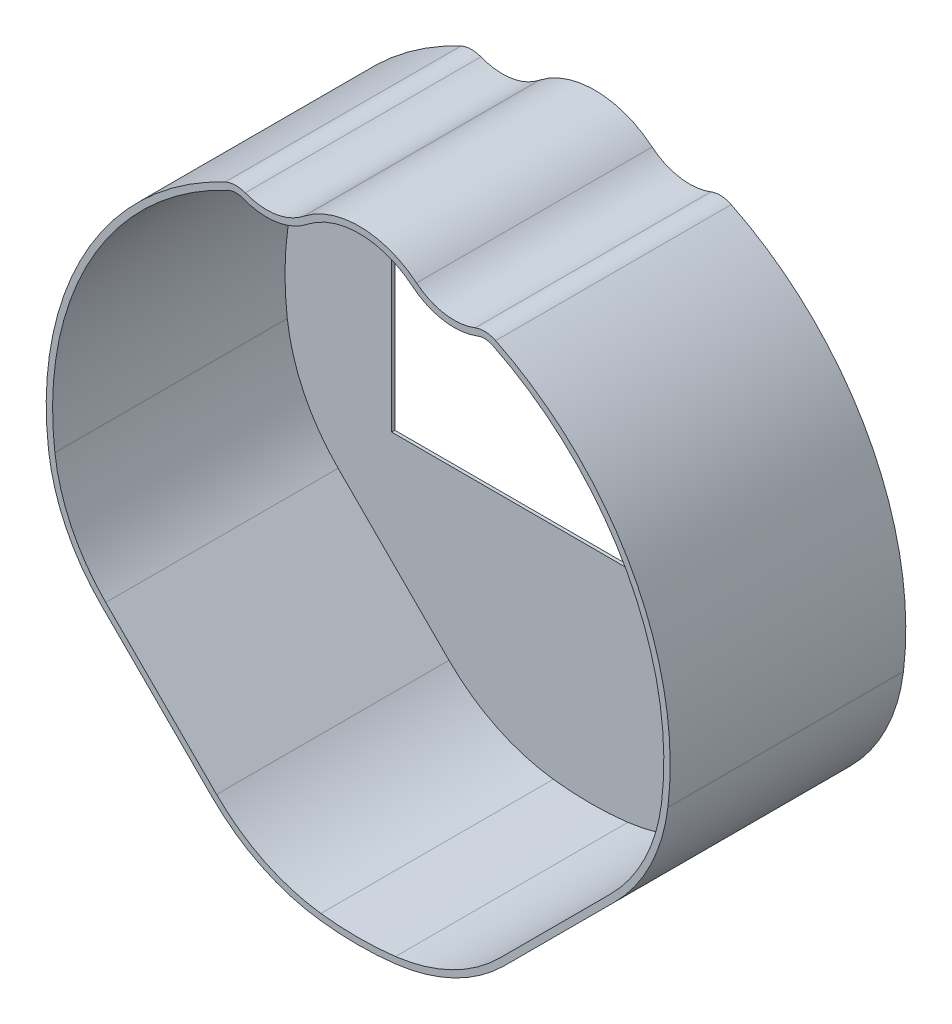
from build123d import *

# Parameters (mm, degrees)
BOSS_EXTRUDE1_DEPTH = 37
CUT_EXTRUDE1_DEPTH  = 36.5
CUT_EXTRUDE2_REACH  = 80.556
SKETCH5_W           = 63.5
SKETCH5_H           = 28


with BuildPart() as part:
    # Sketch1 → Boss-Extrude1 (new body)
    with BuildSketch(Plane.XY):
        with BuildLine():
            Line((40.356535193, -22.947426174), (22.947426174, -40.356535193))
            ThreePointArc((22.947426174, -40.356535193), (15.156681171, -45.914203278), (5.981257322, -48.63357442))
            ThreePointArc((5.981257322, -48.63357442), (0, -49), (-5.981257322, -48.63357442))
            ThreePointArc((-5.981257322, -48.63357442), (-15.156681171, -45.914203278), (-22.947426174, -40.356535193))
            Line((-22.947426174, -40.356535193), (-40.356535193, -22.947426174))
            ThreePointArc((-40.356535193, -22.947426174), (-45.914203278, -15.156681171), (-48.63357442, -5.981257322))
            ThreePointArc((-48.63357442, -5.981257322), (-42.907888217, 23.662483572), (-20.892307913, 44.322809817))
            ThreePointArc((-20.892307913, 44.322809817), (-19.322951214, 44.702303901), (-17.73141344, 44.430451502))
            ThreePointArc((-17.73141344, 44.430451502), (-12.910393927, 43.910800792), (-8.488178405, 45.899839725))
            ThreePointArc((-8.488178405, 45.899839725), (0.386708758, 48.850803922), (9.16390657, 45.62084875))
            ThreePointArc((9.16390657, 45.62084875), (13.572775182, 43.625772556), (18.385878971, 44.128249799))
            ThreePointArc((18.385878971, 44.128249799), (20.002215513, 44.392928913), (21.589134046, 43.987603835))
            ThreePointArc((21.589134046, 43.987603835), (43.093258956, 23.323186587), (48.63357442, -5.981257322))
            ThreePointArc((48.63357442, -5.981257322), (45.914203278, -15.156681171), (40.356535193, -22.947426174))
        make_face()
    extrude(amount=BOSS_EXTRUDE1_DEPTH)

    # Sketch3 → Cut-Extrude1 (cut)
    with BuildSketch(Plane.XY.offset(37)):
        with BuildLine():
            Line((-39.649428412, -22.240319392), (-22.240319392, -39.649428412))
            ThreePointArc((-22.240319392, -39.649428412), (-14.718220769, -45.015452769), (-5.859190846, -47.641052493))
            ThreePointArc((-5.859190846, -47.641052493), (0, -48), (5.859190846, -47.641052493))
            ThreePointArc((5.859190846, -47.641052493), (14.718220769, -45.015452769), (22.240319392, -39.649428412))
            Line((22.240319392, -39.649428412), (39.649428412, -22.240319392))
            ThreePointArc((39.649428412, -22.240319392), (45.015452769, -14.718220769), (47.641052493, -5.859190846))
            ThreePointArc((47.641052493, -5.859190846), (42.213804691, 22.847203188), (21.148539474, 43.089897634))
            ThreePointArc((21.148539474, 43.089897634), (19.958350574, 43.393891443), (18.746098167, 43.195382107))
            ThreePointArc((18.746098167, 43.195382107), (13.413001918, 42.638618817), (8.52781313, 44.849236713))
            ThreePointArc((8.52781313, 44.849236713), (0.378047137, 47.850813988), (-7.865478644, 45.117238565))
            ThreePointArc((-7.865478644, 45.117238565), (-12.761098878, 42.921980343), (-18.095263428, 43.498993941))
            ThreePointArc((-18.095263428, 43.498993941), (-19.288916758, 43.702883241), (-20.465934283, 43.418262678))
            ThreePointArc((-20.465934283, 43.418262678), (-42.032217029, 23.179575744), (-47.641052493, -5.859190846))
            ThreePointArc((-47.641052493, -5.859190846), (-45.015452769, -14.718220769), (-39.649428412, -22.240319392))
        make_face()
    extrude(amount=-CUT_EXTRUDE1_DEPTH, mode=Mode.SUBTRACT)

    # Sketch5 → Cut-Extrude2 (cut, up to next)
    with BuildSketch(Plane(origin=(0, 0, 0), x_dir=(-1, 0, 0), z_dir=(0, 0, -1)), mode=Mode.PRIVATE) as cut_extrude2_sk1:
        with Locations((-0.5, 0.886817972)):
            Rectangle(SKETCH5_W, SKETCH5_H)
    cut_extrude2_tool1 = extrude(cut_extrude2_sk1.sketch, amount=-CUT_EXTRUDE2_REACH, mode=Mode.PRIVATE) & part.part
    add(cut_extrude2_tool1.solids().sort_by_distance((0.5, 0.886818, 0))[0], mode=Mode.SUBTRACT)


solid = part.part
